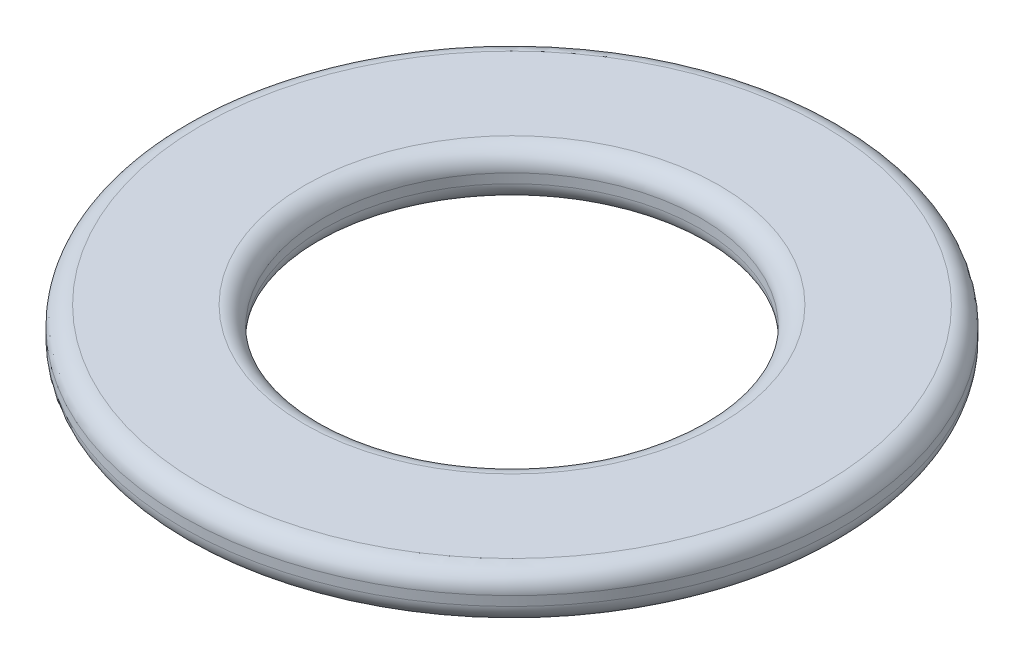
from build123d import *

# Parameters (mm, degrees)
SKETCH1_R           = 8.89
SKETCH1_R_2         = 5.08
BOSS_EXTRUDE1_DEPTH = 1.27
FILLET1_R           = 0.508


with BuildPart() as part:
    # Sketch1 → Boss-Extrude1 (new body)
    with BuildSketch(Plane(origin=(0, 0, 0), x_dir=(1, 0, 0), z_dir=(0, 1, 0))):
        with Locations(Location((0, 0, 0), (0, 0, 270))):
            Circle(SKETCH1_R)
        with Locations(Location((0, 0, 0), (0, 0, 270))):
            Circle(SKETCH1_R_2, mode=Mode.SUBTRACT)
    extrude(amount=BOSS_EXTRUDE1_DEPTH)

    # Fillet1
    fillet1_edges = [part.edges().sort_by_distance(p)[0] for p in [
        (0, 0, -8.89),
        (0, 1.27, -8.89),
        (0, 0, -5.08),
        (0, 1.27, -5.08),
    ]]
    fillet(fillet1_edges, radius=FILLET1_R)


solid = part.part
